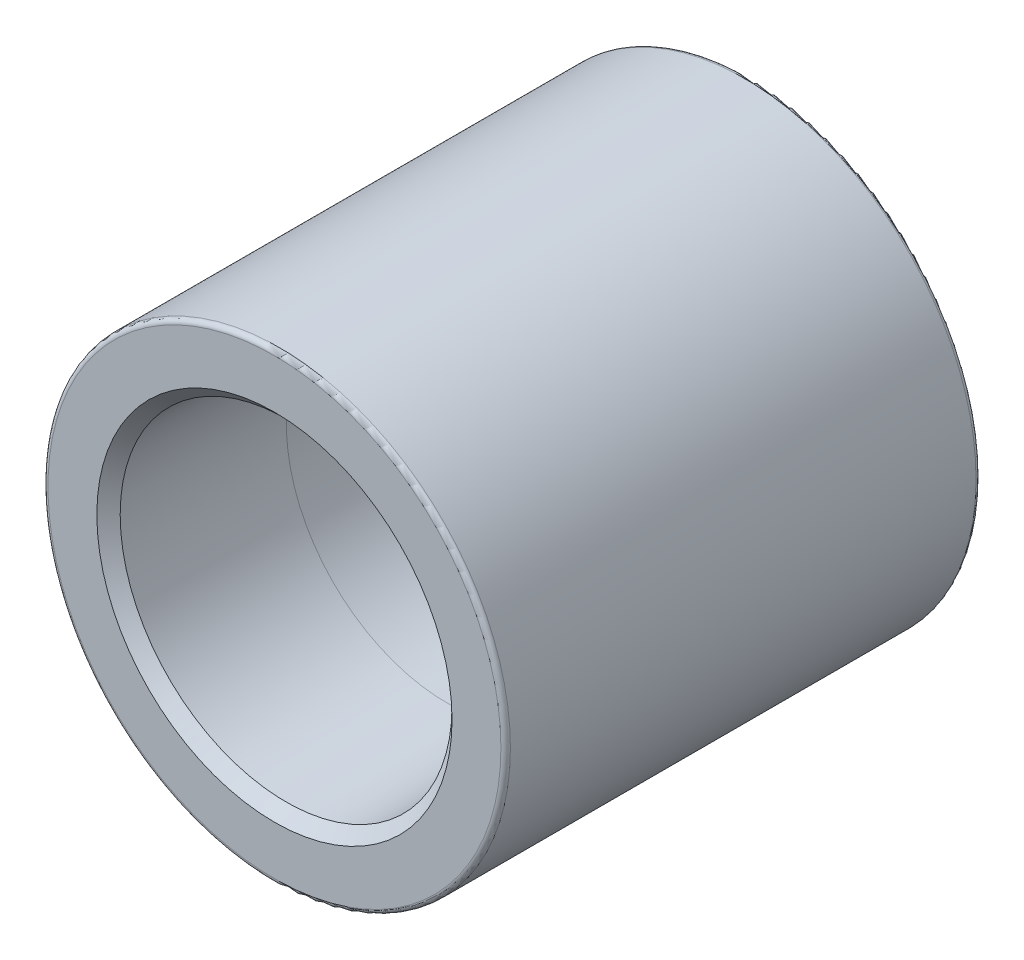
from build123d import *

# Parameters (mm, degrees)
SKETCH1_R                   = 18.542
EXTRUDE1_DEPTH              = 19.05
SKETCH2_R                   = 13.335
CUT_EXTRUDE1_DEPTH          = 13.86078
CUT_EXTRUDE1_DRAFT          = -1.783333333
SKETCH5_R                   = 14.242142857
CUT_EXTRUDE3_DEPTH          = 3.175
CUT_EXTRUDE3_DRAFT          = -45
CIRPATTERN1_COPY_1_SKETCH_R = 13.335
CIRPATTERN1_COPY_1_DEPTH    = 13.86078
CIRPATTERN1_COPY_1_DRAFT    = -1.783333333
CIRPATTERN1_COPY_2_SKETCH_R = 14.242142857
CIRPATTERN1_COPY_2_DEPTH    = 3.175
CIRPATTERN1_COPY_2_DRAFT    = -45
FILLET1_R                   = 0.381
SKETCH8_R                   = 12.903443323
CUT_EXTRUDE5_DEPTH          = 36.709260955


with BuildPart() as part:
    # Sketch1 → Extrude1 (new, symmetric)
    with BuildSketch(Plane.XY):
        Circle(SKETCH1_R)
    extrude(amount=EXTRUDE1_DEPTH, both=True)


with BuildPart() as cut_extrude1_tool:
    # Sketch2 → Cut-Extrude1 (with draft: the straight prism first)
    with BuildSketch(Plane.XY.offset(19.05)):
        Circle(SKETCH2_R)
    extrude(amount=-CUT_EXTRUDE1_DEPTH)
    # Cut-Extrude1: the draft: its side faces are tilted about the plane it starts from
    cut_extrude1_sides = [cut_extrude1_tool.faces().sort_by_distance(p)[0] for p in [
        (-13.335, 0, 12.11961),
    ]]
    draft(cut_extrude1_sides, Plane.XY.offset(19.05), CUT_EXTRUDE1_DRAFT)


with BuildPart() as part_1:
    add(part.part)

    # Cut-Extrude1: cut by cut_extrude1_tool
    add(cut_extrude1_tool.part, mode=Mode.SUBTRACT)


with BuildPart() as cut_extrude3_tool:
    # Sketch5 → Cut-Extrude3 (with draft: the straight prism first)
    with BuildSketch(Plane.XY.offset(19.05)):
        Circle(SKETCH5_R)
    extrude(amount=-CUT_EXTRUDE3_DEPTH)
    # Cut-Extrude3: the draft: its side faces are tilted about the plane it starts from
    cut_extrude3_sides = [cut_extrude3_tool.faces().sort_by_distance(p)[0] for p in [
        (-14.242142857, 0, 17.4625),
    ]]
    draft(cut_extrude3_sides, Plane.XY.offset(19.05), CUT_EXTRUDE3_DRAFT)


with BuildPart() as part_2:
    add(part_1.part)

    # Cut-Extrude3: cut by cut_extrude3_tool
    add(cut_extrude3_tool.part, mode=Mode.SUBTRACT)


with BuildPart() as cirpattern1_copy_1_tool:
    # CirPattern1 copy 1 sketch → CirPattern1 copy 1 (with draft: the straight prism first)
    with BuildSketch(Plane(origin=(0, 0, -19.05), x_dir=(-1, 0, 0), z_dir=(0, 0, -1))):
        Circle(CIRPATTERN1_COPY_1_SKETCH_R)
    extrude(amount=-CIRPATTERN1_COPY_1_DEPTH)
    # CirPattern1 copy 1: the draft: its side faces are tilted about the plane it starts from
    cirpattern1_copy_1_sides = [cirpattern1_copy_1_tool.faces().sort_by_distance(p)[0] for p in [
        (13.335, 0, -12.11961),
    ]]
    draft(cirpattern1_copy_1_sides, Plane(origin=(0, 0, -19.05), x_dir=(-1, 0, 0), z_dir=(0, 0, -1)), CIRPATTERN1_COPY_1_DRAFT)


with BuildPart() as part_3:
    add(part_2.part)

    # CirPattern1 copy 1: cut by cirpattern1_copy_1_tool
    add(cirpattern1_copy_1_tool.part, mode=Mode.SUBTRACT)


with BuildPart() as cirpattern1_copy_2_tool:
    # CirPattern1 copy 2 sketch → CirPattern1 copy 2 (with draft: the straight prism first)
    with BuildSketch(Plane(origin=(0, 0, -19.05), x_dir=(-1, 0, 0), z_dir=(0, 0, -1))):
        Circle(CIRPATTERN1_COPY_2_SKETCH_R)
    extrude(amount=-CIRPATTERN1_COPY_2_DEPTH)
    # CirPattern1 copy 2: the draft: its side faces are tilted about the plane it starts from
    cirpattern1_copy_2_sides = [cirpattern1_copy_2_tool.faces().sort_by_distance(p)[0] for p in [
        (14.242142857, 0, -17.4625),
    ]]
    draft(cirpattern1_copy_2_sides, Plane(origin=(0, 0, -19.05), x_dir=(-1, 0, 0), z_dir=(0, 0, -1)), CIRPATTERN1_COPY_2_DRAFT)


with BuildPart() as part_4:
    add(part_3.part)

    # CirPattern1 copy 2: cut by cirpattern1_copy_2_tool
    add(cirpattern1_copy_2_tool.part, mode=Mode.SUBTRACT)

    # Fillet1
    fillet1_edges = [part_4.edges().sort_by_distance(p)[0] for p in [
        (-18.542, 0, -19.05),
        (-18.542, 0, 19.05),
    ]]
    fillet(fillet1_edges, radius=FILLET1_R)

    # Sketch8 → Cut-Extrude5 (cut, through all)
    with BuildSketch(Plane.XY.offset(5.18922)):
        Circle(SKETCH8_R)
    extrude(amount=-CUT_EXTRUDE5_DEPTH, mode=Mode.SUBTRACT)


solid = part_4.part
